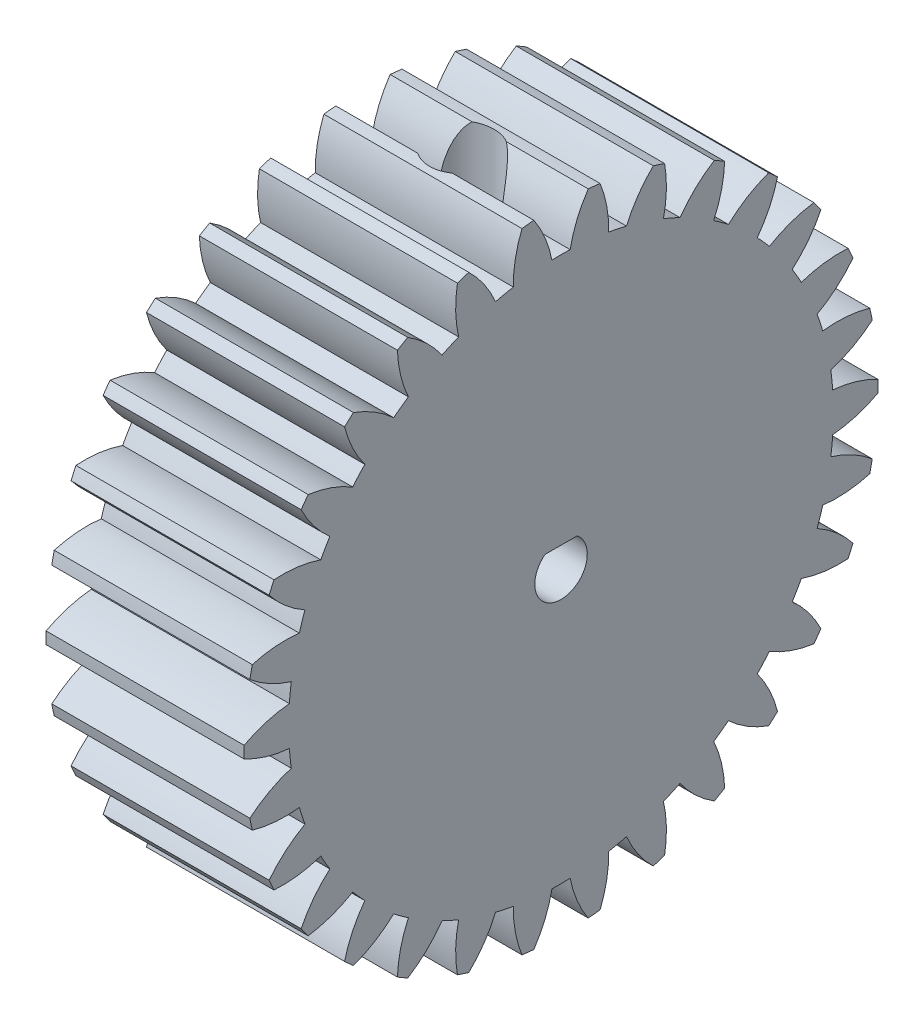
from build123d import *

# Parameters (mm, degrees)
BASPROSKE_W        = 20
BASPROSKE_H        = 32
TOOTHCUT_DEPTH     = 50.477267507
TEETHCUTS_COUNT    = 30
TEETHCUTS_ANGLE    = 348
BORSKE_R           = 0.4
BORE_DEPTH         = 50.0000508
CUT_EXTRUDE1_DEPTH = 50.401035086
SKETCH2_R          = 3.25
CUT_EXTRUDE2_DEPTH = 57.374660755
CUT_EXTRUDE3_REACH = 58.375
SKETCH3_R          = 1.4


with BuildPart() as part:
    # BasProSke → Base-Revolve (revolve)
    with BuildSketch(Plane(origin=(0, 0, 0), x_dir=(1, 0, 0), z_dir=(0, 1, 0)), mode=Mode.PRIVATE) as base_revolve_sk:
        with Locations((10, 16)):
            Rectangle(BASPROSKE_W, BASPROSKE_H)
    revolve(base_revolve_sk.sketch.rotate(Axis((-10, 0, 0), (1, 0, 0)), 180), axis=Axis((-10, 0, 0), (1, 0, 0)))

    # TooCutSke → ToothCut (cut, through all)
    with BuildSketch(Plane(origin=(0, 0, 0), x_dir=(0, 0, -1), z_dir=(1, 0, 0))):
        with BuildLine():
            ThreePointArc((0.918551563, 27.483654488), (0, 27.499), (-0.918551563, 27.483654488))
            ThreePointArc((-0.918551563, 27.483654488), (-1.617208176, 29.787801627), (-2.761784709, 31.906093311))
            ThreePointArc((-2.761784709, 31.906093311), (0, 32.0254), (2.761784709, 31.906093311))
            ThreePointArc((2.761784709, 31.906093311), (1.617208176, 29.787801627), (0.918551563, 27.483654488))
        make_face()
    toothcut = extrude(amount=TOOTHCUT_DEPTH, mode=Mode.SUBTRACT)

    # TeethCuts: ToothCut ×30 about axis
    teethcuts_axis = Axis((-10, 0, 0), (1, 0, 0))
    for i in range(1, TEETHCUTS_COUNT):
        add(toothcut.rotate(teethcuts_axis, i * TEETHCUTS_ANGLE / (TEETHCUTS_COUNT - 1)), mode=Mode.SUBTRACT)

    # BorSke → Bore (cut, symmetric)
    with BuildSketch(Plane(origin=(0, 0, 0), x_dir=(0, 0, -1), z_dir=(1, 0, 0))):
        with Locations(Location((0, 0, 0), (0, 0, 180))):
            Circle(BORSKE_R)
    extrude(amount=BORE_DEPTH, both=True, mode=Mode.SUBTRACT)

    # Sketch1 → Cut-Extrude1 (cut, through all)
    with BuildSketch(Plane.ZY):
        with BuildLine():
            Line((-1.616322988, 2.1), (1.616322988, 2.1))
            ThreePointArc((1.616322988, 2.1), (0, -2.65), (-1.616322988, 2.1))
        make_face()
    extrude(amount=-CUT_EXTRUDE1_DEPTH, mode=Mode.SUBTRACT)

    # Sketch2 → Cut-Extrude2 (cut, through all)
    with BuildSketch(Plane(origin=(0, 10, 0), x_dir=(1, 0, 0), z_dir=(0, 1, 0))):
        with Locations(Location((10, 0, 0), (0, 0, 57.646992589))):
            Circle(SKETCH2_R)
    extrude(amount=CUT_EXTRUDE2_DEPTH, mode=Mode.SUBTRACT)

    # Sketch3 → Cut-Extrude3 (cut, up to next)
    with BuildSketch(Plane(origin=(0, 10, 0), x_dir=(1, 0, 0), z_dir=(0, 1, 0)), mode=Mode.PRIVATE) as cut_extrude3_sk1:
        with Locations(Location((10, 0, 0), (0, 0, 270))):
            Circle(SKETCH3_R)
    cut_extrude3_tool1 = extrude(cut_extrude3_sk1.sketch, amount=-CUT_EXTRUDE3_REACH, mode=Mode.PRIVATE) & part.part
    add(cut_extrude3_tool1.solids().sort_by_distance((10, 10, 0))[0], mode=Mode.SUBTRACT)


solid = part.part
